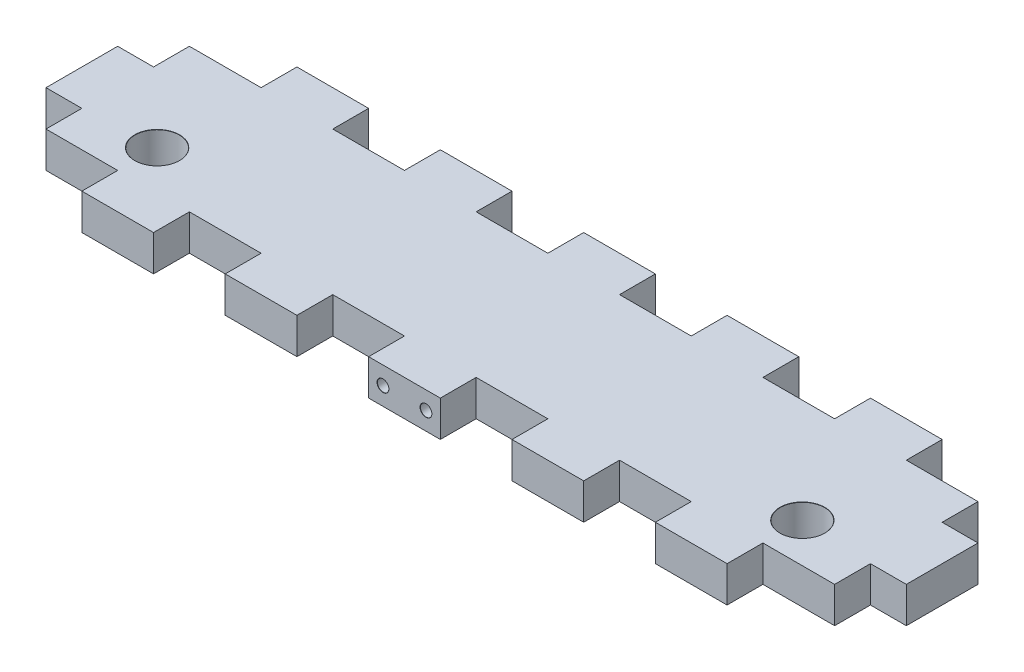
from build123d import *

# Parameters (mm, degrees)
BOSS_EXTRUDE1_DEPTH                  = 2.5
TAP_DRILL_FOR_M2_TAP1_D              = 1.6
TAP_DRILL_FOR_M2_TAP1_DEPTH          = 12
TAP_DRILL_FOR_M2_TAP1_CSINK_D        = 1.65
TAP_DRILL_FOR_M2_TAP1_CSINK_ANGLE    = 90
TAP_DRILL_FOR_M2_TAP1_TIP            = 0.480688495
F_6_2_6_2_DIAMETER_HOLE1_D           = 6.2
F_6_2_6_2_DIAMETER_HOLE1_CSINK_D     = 6.25
F_6_2_6_2_DIAMETER_HOLE1_CSINK_ANGLE = 90


with BuildPart() as part:
    # Sketch1 → Boss-Extrude1 (new, symmetric)
    with BuildSketch(Plane(origin=(0, 0, 0), x_dir=(1, 0, 0), z_dir=(0, 1, 0))):
        Polygon((45, 15), (35, 15), (35, 10), (25, 10), (25, 15), (15, 15), (15, 10), (5, 10), (5, 15), (-5, 15), (-5, 10), (-15, 10), (-15, 15), (-25, 15), (-25, 10), (-35, 10), (-35, 15), (-45, 15), (-45, 10), (-55, 10), (-55, 5), (-60, 5), (-60, -5), (-55, -5), (-55, -10), (-45, -10), (-45, -15), (-35, -15), (-35, -10), (-25, -10), (-25, -15), (-15, -15), (-15, -10), (-5, -10), (-5, -15), (5, -15), (5, -10), (15, -10), (15, -15), (25, -15), (25, -10), (35, -10), (35, -15), (45, -15), (45, -10), (55, -10), (55, -5), (60, -5), (60, 5), (55, 5), (55, 10), (45, 10), align=None)
    extrude(amount=BOSS_EXTRUDE1_DEPTH, both=True)

    # Tap Drill for M2 Tap1
    with Locations(Plane.XY.offset(15)):
        with Locations((-3, 0), (3, 0)):
            CounterSinkHole(TAP_DRILL_FOR_M2_TAP1_D / 2, TAP_DRILL_FOR_M2_TAP1_CSINK_D / 2, depth=TAP_DRILL_FOR_M2_TAP1_DEPTH, counter_sink_angle=TAP_DRILL_FOR_M2_TAP1_CSINK_ANGLE)
            with Locations((0, 0, -(TAP_DRILL_FOR_M2_TAP1_DEPTH + TAP_DRILL_FOR_M2_TAP1_TIP / 2))):  # 118° drill point
                Cone(0, TAP_DRILL_FOR_M2_TAP1_D / 2, TAP_DRILL_FOR_M2_TAP1_TIP, mode=Mode.SUBTRACT)

    # Ø6.2 (6.2) Diameter Hole1 (through all)
    with Locations(Plane(origin=(0, 2.5, 0), x_dir=(1, 0, 0), z_dir=(0, 1, 0))):
        with Locations((-45, -4.5), (45, -4.5)):
            CounterSinkHole(F_6_2_6_2_DIAMETER_HOLE1_D / 2, F_6_2_6_2_DIAMETER_HOLE1_CSINK_D / 2, counter_sink_angle=F_6_2_6_2_DIAMETER_HOLE1_CSINK_ANGLE)


solid = part.part
